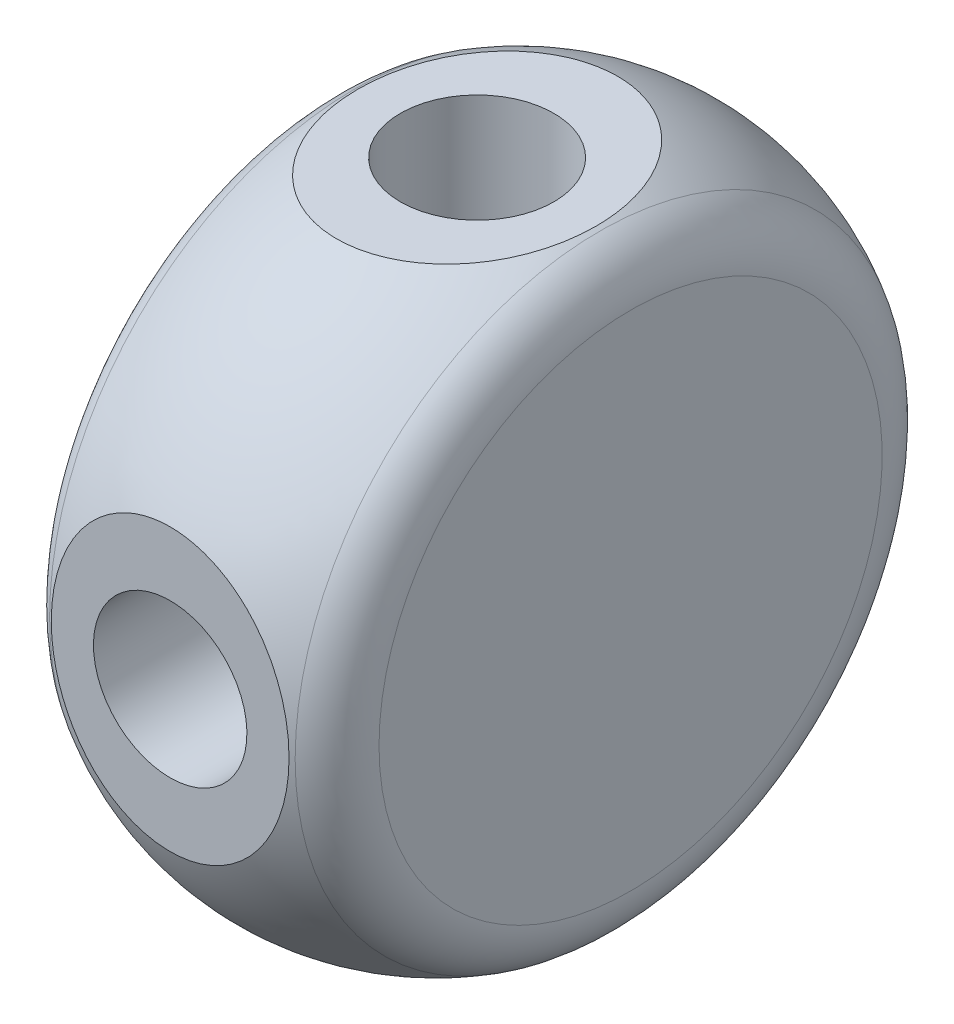
from build123d import *

# Parameters (mm, degrees)
SKETCH1_W           = 20
SKETCH1_H           = 20
BOSS_EXTRUDE1_DEPTH = 5
CIRPATTERN1_COUNT   = 4
FILLET1_R           = 2


with BuildPart() as part:
    # Sketch1 → Boss-Extrude1 (new, symmetric)
    with BuildSketch(Plane(origin=(0, 0, 0), x_dir=(0, 0, -1), z_dir=(1, 0, 0))):
        Rectangle(SKETCH1_W, SKETCH1_H)
    extrude(amount=BOSS_EXTRUDE1_DEPTH, both=True)

    # Sketch5 → Cut-Revolve3 (revolve, cut)
    with BuildSketch(Plane(origin=(0, 0, 0), x_dir=(1, 0, 0), z_dir=(0, 0.7071067811865477, 0.7071067811865475)), mode=Mode.PRIVATE) as cut_revolve3_sk:
        with BuildLine():
            Line((-5, 9.244997998), (-5, 18.244997998))
            Line((-5, 18.244997998), (5, 18.244997998))
            Line((5, 18.244997998), (5, 9.244997998))
            ThreePointArc((5, 9.244997998), (0, 11), (-5, 9.244997998))
        make_face()
    revolve(cut_revolve3_sk.sketch.rotate(Axis((-5.750529674, 0, 0), (1, 0, 0)), 135), axis=Axis((-5.750529674, 0, 0), (1, 0, 0)), mode=Mode.SUBTRACT)

    # Sketch8 → Tap Drill for M6 Tap1 (revolve, cut)
    with BuildSketch(Plane(origin=(0, 10, 0), x_dir=(0, 0, 1), z_dir=(1, 0, 0))):
        Polygon((0, 0), (0, 7.502151548), (2.5, 6), (2.5, 0), align=None)
    tap_drill_for_m6_tap1 = revolve(axis=Axis((0, 16.35, 0), (0, -1, 0)), mode=Mode.SUBTRACT)

    # CirPattern1: Tap Drill for M6 Tap1 ×4 about axis
    cirpattern1_axis = Axis((0, 0, 0), (1, 0, 0))
    for i in range(1, CIRPATTERN1_COUNT):
        add(tap_drill_for_m6_tap1.rotate(cirpattern1_axis, i * 360 / CIRPATTERN1_COUNT), mode=Mode.SUBTRACT)

    # Fillet1
    fillet1_edges = [part.edges().sort_by_distance(p)[0] for p in [
        (5, 0, -9.244997998),
        (-5, 0, -9.244997998),
    ]]
    fillet(fillet1_edges, radius=FILLET1_R)


solid = part.part
